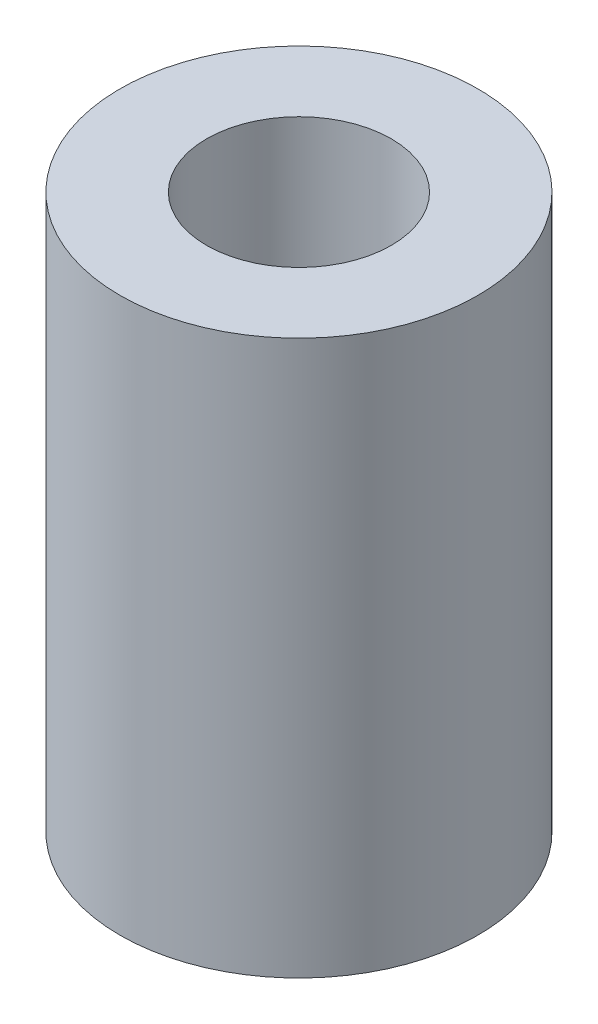
from build123d import *

# Parameters (mm, degrees)
SKETCH1_R           = 7.75
SKETCH1_R_2         = 4
BOSS_EXTRUDE1_DEPTH = 24


with BuildPart() as part:
    # Sketch1 → Boss-Extrude1 (new body)
    with BuildSketch(Plane(origin=(0, 0, 0), x_dir=(1, 0, 0), z_dir=(0, 1, 0))):
        with Locations(Location((0, 0, 0), (0, 0, 270))):
            Circle(SKETCH1_R)
        with Locations(Location((0, 0, 0), (0, 0, 270))):
            Circle(SKETCH1_R_2, mode=Mode.SUBTRACT)
    extrude(amount=BOSS_EXTRUDE1_DEPTH)


solid = part.part
